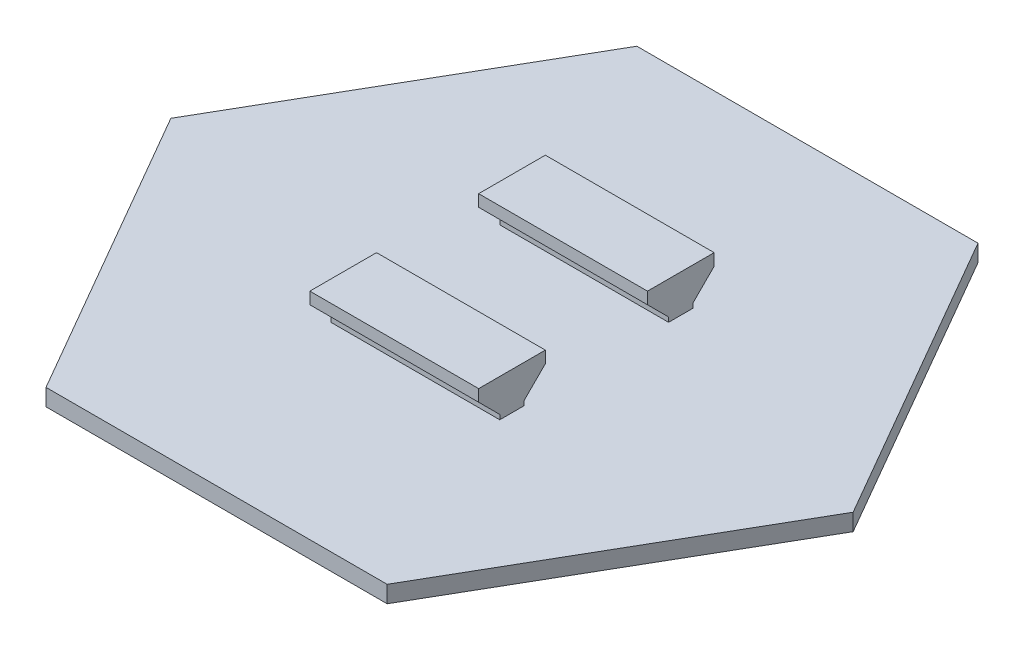
from build123d import *

# Parameters (mm, degrees)
BOSS_EXTRUDE1_DEPTH = 1
SKETCH2_W           = 2.9
SKETCH2_H           = 0.55
BOSS_EXTRUDE2_DEPTH = 10


with BuildPart() as part:
    # Sketch1 → Boss-Extrude1 (new, symmetric)
    with BuildSketch(Plane(origin=(0, 0, 0), x_dir=(1, 0, 0), z_dir=(0, 1, 0))):
        Polygon((40.414518843, 0), (20.207259422, 35), (-20.207259422, 35), (-40.414518843, 0), (-20.207259422, -35), (20.207259422, -35), align=None)
    extrude(amount=BOSS_EXTRUDE1_DEPTH, both=True)

    # Sketch2 → Boss-Extrude2 (add, symmetric)
    with BuildSketch(Plane(origin=(0, 0, 0), x_dir=(0, 0, -1), z_dir=(1, 0, 0))):
        Polygon((6.05, 5.45), (6.05, 4.05), (8.55, 1.55), (11.45, 1.55), (13.95, 4.05), (13.95, 5.45), align=None)
        Polygon((-6.05, 5.45), (-6.05, 4.05), (-8.55, 1.55), (-11.45, 1.55), (-13.95, 4.05), (-13.95, 5.45), align=None)
        with Locations((-10, 1.275)):
            Rectangle(SKETCH2_W, SKETCH2_H)
        with Locations((10, 1.275)):
            Rectangle(SKETCH2_W, SKETCH2_H)
    extrude(amount=BOSS_EXTRUDE2_DEPTH, both=True)


solid = part.part
